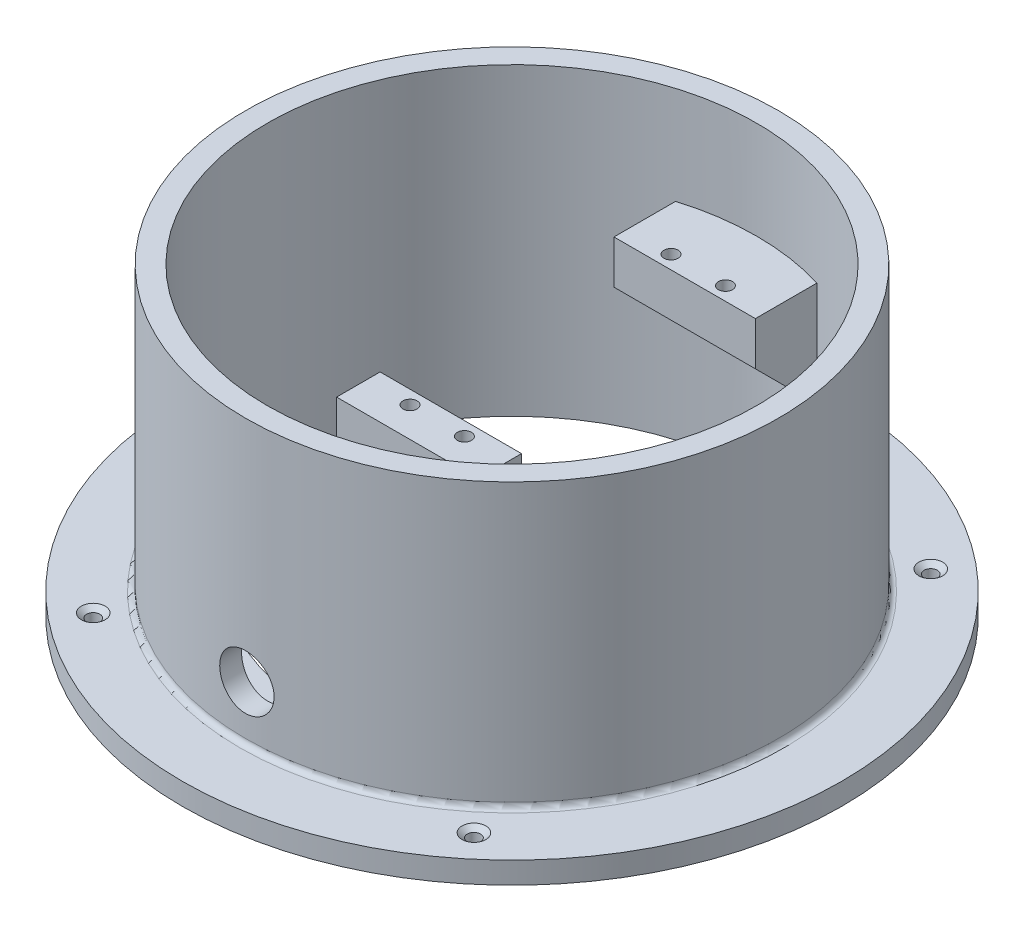
from build123d import *

# Parameters (mm, degrees)
SKETCH1_R                                 = 60.625
SKETCH1_R_2                               = 45
BOSS_EXTRUDE1_DEPTH                       = 4
SKETCH2_R                                 = 49
SKETCH2_R_2                               = 45
BOSS_EXTRUDE2_DEPTH                       = 52
SKETCH3_W                                 = 13.25
SKETCH3_H                                 = 8
SKETCH3_W_2                               = 8
SKETCH3_H_2                               = 38
BOSS_EXTRUDE3_DEPTH                       = 13
SKETCH4_W                                 = 10
SKETCH4_H                                 = 24
CUT_EXTRUDE1_DEPTH                        = 26
SKETCH7_R                                 = 5
CUT_EXTRUDE2_DEPTH                        = 64
SKETCH11_R                                = 1.3
CUT_EXTRUDE5_DEPTH                        = 7.2
BOSS_EXTRUDE4_DEPTH                       = 4
CSK_FOR_2_FLAT_HEAD_MACHINE_SCREW_2_COUNT = 2
CSK_FOR_2_FLAT_HEAD_MACHINE_SCREW_2_PITCH = 70
CSK_FOR_2_FLAT_HEAD_MACHINE_SCREW_3_COUNT = 2
CSK_FOR_2_FLAT_HEAD_MACHINE_SCREW_3_PITCH = 109.343495463
CSK_FOR_2_FLAT_HEAD_MACHINE_SCREW_4_COUNT = 2
CSK_FOR_2_FLAT_HEAD_MACHINE_SCREW_4_PITCH = 84
FILLET1_R                                 = 1


with BuildPart() as part:
    # Sketch1 → Boss-Extrude1 (new body)
    with BuildSketch(Plane(origin=(0, 0, 0), x_dir=(1, 0, 0), z_dir=(0, 1, 0))):
        with Locations(Location((0, 0, 0), (0, 0, 270))):
            Circle(SKETCH1_R)
        with Locations(Location((0, 0, 0), (0, 0, 270))):
            Circle(SKETCH1_R_2, mode=Mode.SUBTRACT)
    extrude(amount=BOSS_EXTRUDE1_DEPTH)

    # Sketch2 → Boss-Extrude2 (add)
    with BuildSketch(Plane(origin=(0, 4, 0), x_dir=(1, 0, 0), z_dir=(0, 1, 0))):
        with Locations(Location((0, 0, 0), (0, 0, 90))):
            Circle(SKETCH2_R)
        with Locations(Location((0, 0, 0), (0, 0, 270))):
            Circle(SKETCH2_R_2, mode=Mode.SUBTRACT)
    extrude(amount=BOSS_EXTRUDE2_DEPTH)

    # Sketch3 → Boss-Extrude3 (add, symmetric)
    with BuildSketch(Plane(origin=(0, 0, 0), x_dir=(0, 0, -1), z_dir=(1, 0, 0))):
        with Locations((38.375, 34)):
            Rectangle(SKETCH3_W, SKETCH3_H)
        Polygon((45, 16.75), (45, 30), (31.75, 30), align=None)
        with Locations((-15.25, 19)):
            Rectangle(SKETCH3_W_2, SKETCH3_H_2)
    extrude(amount=BOSS_EXTRUDE3_DEPTH, both=True)


with BuildPart() as boss_extrude3_piece_1:
    # of the separate pieces the step leaves, piece 1, a body of its own (boss_extrude3_pieces)
    add(part.part.solids().sort_by_distance((0, 0, 60.625))[0])

    # Sketch7 → Cut-Extrude2 (cut)
    with BuildSketch(Plane(origin=(0, 0, 11.25), x_dir=(-1, 0, 0), z_dir=(0, 0, -1))):
        with Locations(Location((0, 14, 0), (0, 0, 90))):
            Circle(SKETCH7_R)
    extrude(amount=-CUT_EXTRUDE2_DEPTH, mode=Mode.SUBTRACT)


with BuildPart() as boss_extrude3_piece_2:
    # of the separate pieces the step leaves, piece 2, a body of its own (boss_extrude3_pieces)
    add(part.part.solids().sort_by_distance((-13, 38, 11.25))[0])

    # Sketch4 → Cut-Extrude1 (cut)
    with BuildSketch(Plane(origin=(0, 0, 11.25), x_dir=(-1, 0, 0), z_dir=(0, 0, -1))):
        with Locations((0, 17)):
            Rectangle(SKETCH4_W, SKETCH4_H)
    extrude(amount=-CUT_EXTRUDE1_DEPTH, mode=Mode.SUBTRACT)


with BuildPart() as cut_extrude5_tool:
    # Sketch11 → Cut-Extrude5 (new body)
    with BuildSketch(Plane(origin=(0, 38, 0), x_dir=(1, 0, 0), z_dir=(0, 1, 0))):
        with Locations(Location((-5, 34.25, 0), (0, 0, 270))):
            Circle(SKETCH11_R)
        with Locations(Location((5, 34.25, 0), (0, 0, 270))):
            Circle(SKETCH11_R)
        with Locations(Location((-5, -13.75, 0), (0, 0, 270))):
            Circle(SKETCH11_R)
        with Locations(Location((5, -13.75, 0), (0, 0, 270))):
            Circle(SKETCH11_R)
    extrude(amount=-CUT_EXTRUDE5_DEPTH)


with BuildPart() as boss_extrude3_piece_1_1:
    add(boss_extrude3_piece_1.part)

    # Cut-Extrude5: cut by cut_extrude5_tool
    add(cut_extrude5_tool.part, mode=Mode.SUBTRACT)

    # Sketch14 → CSK for #2 Flat Head Machine Screw (100)1 (revolve, cut)
    with BuildSketch(Plane(origin=(35, 4, -42), x_dir=(0, 0, 1), z_dir=(1, 0, 0))):
        Polygon((0, 0), (0, 4), (1.2192, 4), (1.2192, 0.809898964), (2.1844, 0), align=None)
    csk_for_2_flat_head_machine_screw_100 = revolve(axis=Axis((35, 10.35, -42), (0, -1, 0)), mode=Mode.SUBTRACT)

    # CSK for _2 Flat Head Machine Screw _ 2: CSK for #2 Flat Head Machine Screw (100)1 ×2
    with Locations(*[(-i * CSK_FOR_2_FLAT_HEAD_MACHINE_SCREW_2_PITCH, 0, 0) for i in range(1, CSK_FOR_2_FLAT_HEAD_MACHINE_SCREW_2_COUNT)]):
        add(csk_for_2_flat_head_machine_screw_100, mode=Mode.SUBTRACT)

    # CSK for _2 Flat Head Machine Screw _ 3: CSK for #2 Flat Head Machine Screw (100)1 ×2
    with Locations(*[Vector(-0.6401843996644799, 0, 0.7682212795973759) * (i * CSK_FOR_2_FLAT_HEAD_MACHINE_SCREW_3_PITCH) for i in range(1, CSK_FOR_2_FLAT_HEAD_MACHINE_SCREW_3_COUNT)]):
        add(csk_for_2_flat_head_machine_screw_100, mode=Mode.SUBTRACT)

    # CSK for _2 Flat Head Machine Screw _ 4: CSK for #2 Flat Head Machine Screw (100)1 ×2
    with Locations(*[(0, 0, i * CSK_FOR_2_FLAT_HEAD_MACHINE_SCREW_4_PITCH) for i in range(1, CSK_FOR_2_FLAT_HEAD_MACHINE_SCREW_4_COUNT)]):
        add(csk_for_2_flat_head_machine_screw_100, mode=Mode.SUBTRACT)

    # Fillet1
    fillet1_edges = [boss_extrude3_piece_1_1.edges().sort_by_distance(p)[0] for p in [
        (0, 4, 49),
    ]]
    fillet(fillet1_edges, radius=FILLET1_R)


with BuildPart() as boss_extrude3_piece_2_1:
    add(boss_extrude3_piece_2.part)

    # Cut-Extrude5: cut by cut_extrude5_tool
    add(cut_extrude5_tool.part, mode=Mode.SUBTRACT)

    # Sketch12 → Boss-Extrude4 (add)
    with BuildSketch(Plane.XZ):
        with BuildLine():
            Line((13, 11.25), (-13, 11.25))
            Line((-13, 11.25), (-37.248431585, 25.249838503))
            ThreePointArc((-37.248431585, 25.249838503), (0, 45), (37.248431585, 25.249838503))
            Line((37.248431585, 25.249838503), (13, 11.25))
        make_face()
        with BuildLine():
            Line((-24.906460381, 27.361802413), (-19.516660498, 24.25))
            Line((-19.516660498, 24.25), (19.516660498, 24.25))
            Line((19.516660498, 24.25), (24.906460381, 27.361802413))
            ThreePointArc((24.906460381, 27.361802413), (0, 37), (-24.906460381, 27.361802413))
        make_face(mode=Mode.SUBTRACT)
    extrude(amount=-BOSS_EXTRUDE4_DEPTH)


solid = Compound([boss_extrude3_piece_1_1.part, boss_extrude3_piece_2_1.part])
